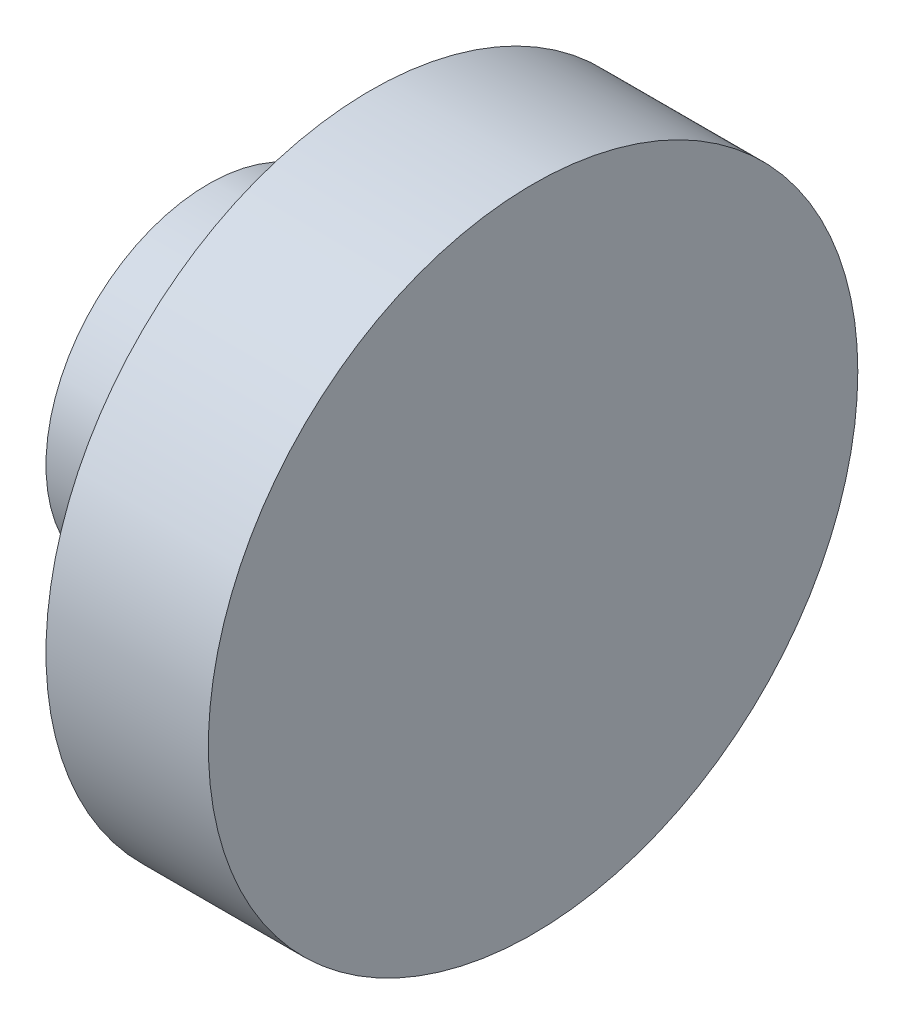
from build123d import *

# Parameters (mm, degrees)
F_1_4_20_TAPPED_HOLE1_D     = 5.1054
F_1_4_20_TAPPED_HOLE1_DEPTH = 7.62
F_1_4_20_TAPPED_HOLE1_TIP   = 1.533816902


with BuildPart() as part:
    # Sketch2 → Revolve1 (revolve)
    with BuildSketch(Plane.XY, mode=Mode.PRIVATE) as revolve1_sk:
        Polygon((0, 0), (0, 6.35), (6.35, 6.35), (6.35, 12.7), (12.7, 12.7), (12.7, 0), align=None)
    revolve(revolve1_sk.sketch.rotate(Axis((12.7, 0, 0), (-1, 0, 0)), 90), axis=Axis((12.7, 0, 0), (-1, 0, 0)))

    # 1/4-20 Tapped Hole1
    with Locations(Plane(origin=(0, 0, 0), x_dir=(0, 0, -1), z_dir=(-1, 0, 0))):
        with Locations((0, 0)):
            Hole(F_1_4_20_TAPPED_HOLE1_D / 2, depth=F_1_4_20_TAPPED_HOLE1_DEPTH)
            with Locations((0, 0, -(F_1_4_20_TAPPED_HOLE1_DEPTH + F_1_4_20_TAPPED_HOLE1_TIP / 2))):  # 118° drill point
                Cone(0, F_1_4_20_TAPPED_HOLE1_D / 2, F_1_4_20_TAPPED_HOLE1_TIP, mode=Mode.SUBTRACT)


solid = part.part
